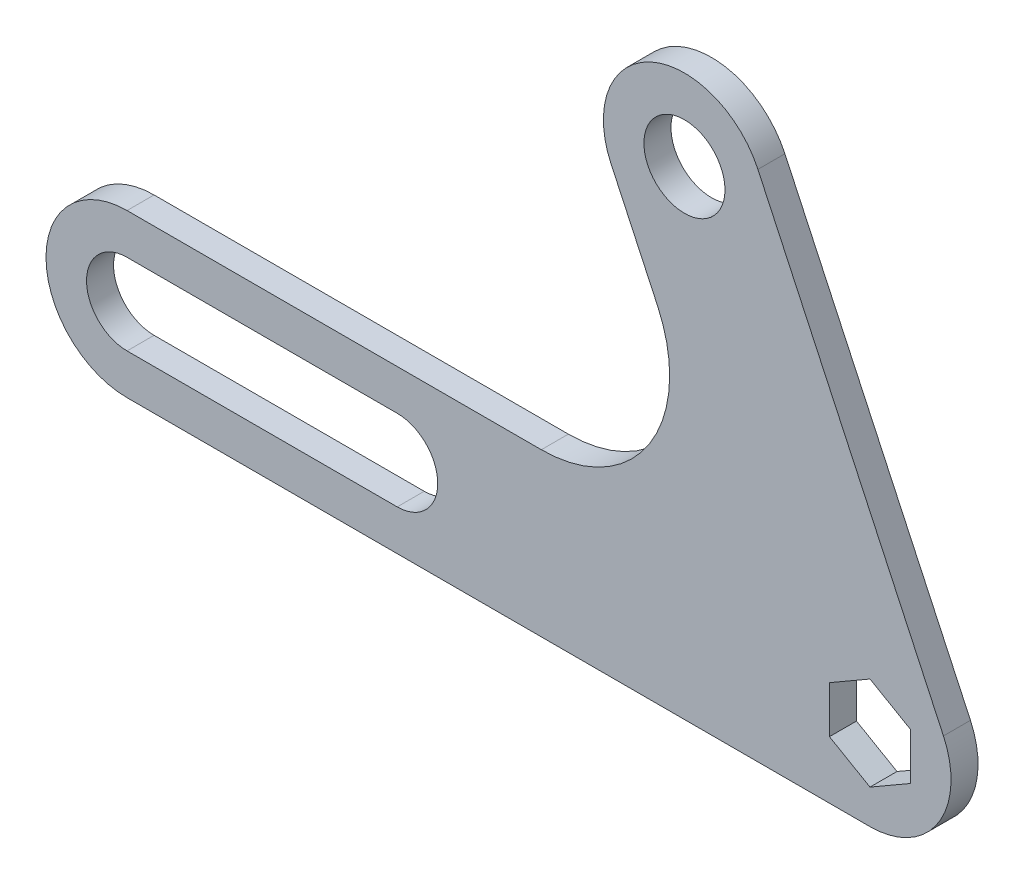
from build123d import *

# Parameters (mm, degrees)
SKETCH1_R           = 6
BOSS_EXTRUDE1_DEPTH = 4


with BuildPart() as part:
    # Sketch1 → Boss-Extrude1 (new body)
    with BuildSketch(Plane.XY):
        with BuildLine():
            Line((0, 0), (110, 0))
            ThreePointArc((110, 0), (120.12069735, 5.5524047), (120.875693444, 17.071419141))
            Line((120.875693444, 17.071419141), (93.405506431, 75.981425298))
            ThreePointArc((93.405506431, 75.981425298), (77.458393846, 81.785699602), (71.654119542, 65.838587016))
            Line((71.654119542, 65.838587016), (78.559595063, 51.029746973))
            ThreePointArc((78.559595063, 51.029746973), (77.36418458, 32.791307441), (61.339747109, 24))
            Line((61.339747109, 24), (0, 24))
            ThreePointArc((0, 24), (-12, 12), (0, 0))
        make_face()
        with Locations((82.529812987, 70.910006157)):
            Circle(SKETCH1_R, mode=Mode.SUBTRACT)
        with BuildLine():
            Line((0, 18), (40, 18))
            ThreePointArc((40, 18), (46, 12), (40, 6))
            Line((40, 6), (0, 6))
            ThreePointArc((0, 6), (-6, 12), (0, 18))
        make_face(mode=Mode.SUBTRACT)
        Polygon((110, 18.92820323), (104, 15.464101615), (104, 8.535898385), (110, 5.07179677), (116, 8.535898385), (116, 15.464101615), align=None, mode=Mode.SUBTRACT)
    extrude(amount=BOSS_EXTRUDE1_DEPTH)


solid = part.part
